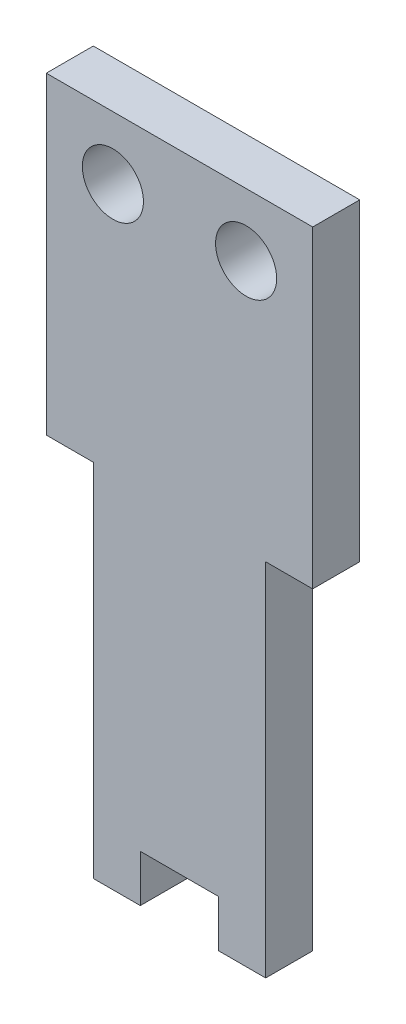
from build123d import *

# Parameters (mm, degrees)
BOSS_EXTRUDE1_DEPTH = 3
SKETCH2_R           = 1.95
CUT_EXTRUDE1_DEPTH  = 25.703238654
SKETCH3_W           = 3
SKETCH3_H           = 4
CUT_EXTRUDE2_DEPTH  = 25.703238654
SKETCH4_W           = 3
SKETCH4_H           = 16
CUT_EXTRUDE3_DEPTH  = 10


with BuildPart() as part:
    # Sketch1 → Boss-Extrude1 (new body)
    with BuildSketch(Plane.XY):
        Polygon((8.5, -20), (5.5, -20), (5.5, -23), (2.5, -23), (2.5, -20), (-2.5, -20), (-2.5, -23), (-5.5, -23), (-5.5, -20), (-8.5, -20), (-8.5, 20), (8.5, 20), align=None)
    extrude(amount=BOSS_EXTRUDE1_DEPTH)

    # Sketch2 → Cut-Extrude1 (cut, through all)
    with BuildSketch(Plane.XY.offset(3)):
        with Locations((-4.25, 16)):
            Circle(SKETCH2_R)
        with Locations((4.25, 16)):
            Circle(SKETCH2_R)
    extrude(amount=-CUT_EXTRUDE1_DEPTH, mode=Mode.SUBTRACT)

    # Sketch3 → Cut-Extrude2 (cut, through all)
    with BuildSketch(Plane.XY.offset(3)):
        with Locations((-7, -18)):
            Rectangle(SKETCH3_W, SKETCH3_H)
        with Locations((7, -18)):
            Rectangle(SKETCH3_W, SKETCH3_H)
    extrude(amount=-CUT_EXTRUDE2_DEPTH, mode=Mode.SUBTRACT)

    # Sketch4 → Cut-Extrude3 (cut)
    with BuildSketch(Plane.XY.offset(3)):
        with Locations((-7, -8)):
            Rectangle(SKETCH4_W, SKETCH4_H)
        with Locations((7, -8)):
            Rectangle(SKETCH4_W, SKETCH4_H)
    extrude(amount=-CUT_EXTRUDE3_DEPTH, mode=Mode.SUBTRACT)


solid = part.part
